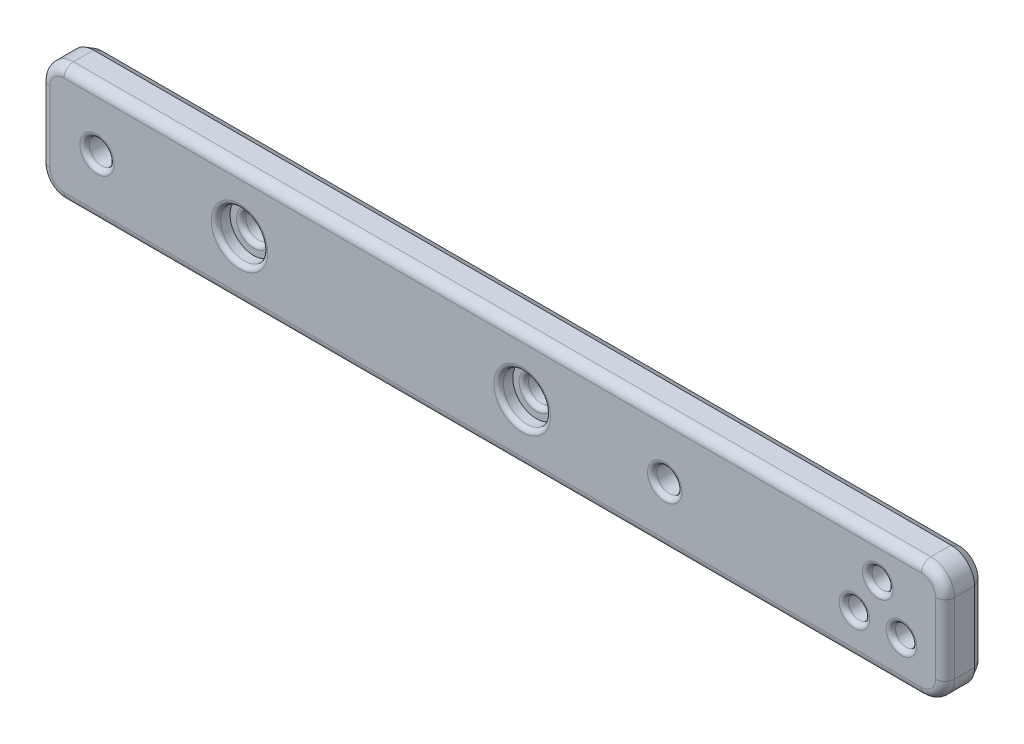
from build123d import *
from OCP.BRepFilletAPI import BRepFilletAPI_MakeChamfer

# Parameters (mm, degrees)
SKETCH2_W           = 192
SKETCH2_H           = 25
BOSS_EXTRUDE1_DEPTH = 8
SKETCH3_R           = 2.65
SKETCH3_R_2         = 2.25
CUT_EXTRUDE1_DEPTH  = 98.140362363
SKETCH4_R           = 5
CUT_EXTRUDE2_DEPTH  = 3
FILLET1_R           = 5
FILLET2_R           = 2
FILLET3_R           = 1
CHAMFER1_SIZE       = 1
CHAMFER1_SIZE2      = 1.732050808
CHAMFER2_SIZE       = 1
CHAMFER2_SIZE2      = 0.577350269


with BuildPart() as part:
    # Sketch2 → Boss-Extrude1 (new body)
    with BuildSketch(Plane.XY):
        Rectangle(SKETCH2_W, SKETCH2_H)
    extrude(amount=BOSS_EXTRUDE1_DEPTH)

    # Sketch3 → Cut-Extrude1 (cut, through all)
    with BuildSketch(Plane.XY.offset(8)):
        with Locations((-84, 0)):
            Circle(SKETCH3_R)
        with Locations((36.5, 0)):
            Circle(SKETCH3_R)
        with Locations((76.75, -3.5)):
            Circle(SKETCH3_R_2)
        with Locations((86.75, -3.5)):
            Circle(SKETCH3_R_2)
        with Locations((81.75, 4.5)):
            Circle(SKETCH3_R_2)
        with Locations((-53.75, 0)):
            Circle(SKETCH3_R)
        with Locations((6.25, 0)):
            Circle(SKETCH3_R)
    extrude(amount=-CUT_EXTRUDE1_DEPTH, mode=Mode.SUBTRACT)

    # Sketch4 → Cut-Extrude2 (cut)
    with BuildSketch(Plane.XY.offset(8)):
        with Locations((-53.75, 0)):
            Circle(SKETCH4_R)
        with Locations((6.25, 0)):
            Circle(SKETCH4_R)
    extrude(amount=-CUT_EXTRUDE2_DEPTH, mode=Mode.SUBTRACT)

    # Fillet1
    fillet1_edges = [part.edges().sort_by_distance(p)[0] for p in [
        (-96, -12.5, 4),
        (-96, 12.5, 4),
        (96, -12.5, 4),
        (96, 12.5, 4),
    ]]
    fillet(fillet1_edges, radius=FILLET1_R)

    # Fillet2
    fillet2_edges = [part.edges().sort_by_distance(p)[0] for p in [
        (94.535533906, 11.035533906, 8),
        (96, 0, 8),
        (94.535533906, -11.035533906, 8),
        (0, -12.5, 8),
        (-94.535533906, -11.035533906, 8),
        (-96, 0, 8),
        (-94.535533906, 11.035533906, 8),
        (0, 12.5, 8),
    ]]
    fillet(fillet2_edges, radius=FILLET2_R)

    # Fillet3
    fillet3_edges = [part.edges().sort_by_distance(p)[0] for p in [
        (79.5, 4.5, 8),
        (84.5, -3.5, 8),
        (74.5, -3.5, 8),
        (33.85, 0, 8),
        (-86.65, 0, 8),
        (3.6, 0, 5),
        (-56.4, 0, 5),
        (1.25, 0, 8),
        (-58.75, 0, 8),
    ]]
    fillet(fillet3_edges, radius=FILLET3_R)

    # Chamfer1
    chamfer1_edges = [part.edges().sort_by_distance(p)[0] for p in [
        (0, 12.5, 0),
        (-94.535533906, 11.035533906, 0),
        (94.535533906, 11.035533906, 0),
        (-96, 0, 0),
        (96, 0, 0),
        (-94.535533906, -11.035533906, 0),
        (94.535533906, -11.035533906, 0),
        (0, -12.5, 0),
    ]]
    chamfer1_side = [part.faces().sort_by_distance(p)[0] for p in [
        (-0.388718908, 0.008564373, 0),
    ]]
    chamfer(chamfer1_edges, length=CHAMFER1_SIZE, length2=CHAMFER1_SIZE2, reference=chamfer1_side[0])

    # Chamfer2: one chamfer whose edges measure the first distance from different faces: ONE call of the kernel's chamfer builder (chamfer() names one face for all edges)
    chamfer2_edges_1 = [part.edges().sort_by_distance(p)[0] for p in [
        (84.5, -3.5, 0),
    ]]
    chamfer2_side_1 = [part.faces().sort_by_distance(p)[0] for p in [
        (84.5, -3.5, 3.5),
    ]]
    chamfer2_edges_2 = [part.edges().sort_by_distance(p)[0] for p in [
        (79.5, 4.5, 0),
    ]]
    chamfer2_side_2 = [part.faces().sort_by_distance(p)[0] for p in [
        (79.5, 4.5, 3.5),
    ]]
    chamfer2_edges_3 = [part.edges().sort_by_distance(p)[0] for p in [
        (74.5, -3.5, 0),
    ]]
    chamfer2_side_3 = [part.faces().sort_by_distance(p)[0] for p in [
        (74.5, -3.5, 3.5),
    ]]
    chamfer2_edges_4 = [part.edges().sort_by_distance(p)[0] for p in [
        (33.85, 0, 0),
    ]]
    chamfer2_side_4 = [part.faces().sort_by_distance(p)[0] for p in [
        (33.85, 0, 3.5),
    ]]
    chamfer2_edges_5 = [part.edges().sort_by_distance(p)[0] for p in [
        (3.6, 0, 0),
    ]]
    chamfer2_side_5 = [part.faces().sort_by_distance(p)[0] for p in [
        (3.6, 0, 2),
    ]]
    chamfer2_edges_6 = [part.edges().sort_by_distance(p)[0] for p in [
        (-56.4, 0, 0),
    ]]
    chamfer2_side_6 = [part.faces().sort_by_distance(p)[0] for p in [
        (-56.4, 0, 2),
    ]]
    chamfer2_edges_7 = [part.edges().sort_by_distance(p)[0] for p in [
        (-86.65, 0, 0),
    ]]
    chamfer2_side_7 = [part.faces().sort_by_distance(p)[0] for p in [
        (-86.65, 0, 3.5),
    ]]
    chamfer2 = BRepFilletAPI_MakeChamfer(part.part.solid().wrapped)
    for e in chamfer2_edges_1:
        chamfer2.Add(CHAMFER2_SIZE, CHAMFER2_SIZE2, e.wrapped, chamfer2_side_1[0].wrapped)  # the first distance lies on this face
    for e in chamfer2_edges_2:
        chamfer2.Add(CHAMFER2_SIZE, CHAMFER2_SIZE2, e.wrapped, chamfer2_side_2[0].wrapped)  # the first distance lies on this face
    for e in chamfer2_edges_3:
        chamfer2.Add(CHAMFER2_SIZE, CHAMFER2_SIZE2, e.wrapped, chamfer2_side_3[0].wrapped)  # the first distance lies on this face
    for e in chamfer2_edges_4:
        chamfer2.Add(CHAMFER2_SIZE, CHAMFER2_SIZE2, e.wrapped, chamfer2_side_4[0].wrapped)  # the first distance lies on this face
    for e in chamfer2_edges_5:
        chamfer2.Add(CHAMFER2_SIZE, CHAMFER2_SIZE2, e.wrapped, chamfer2_side_5[0].wrapped)  # the first distance lies on this face
    for e in chamfer2_edges_6:
        chamfer2.Add(CHAMFER2_SIZE, CHAMFER2_SIZE2, e.wrapped, chamfer2_side_6[0].wrapped)  # the first distance lies on this face
    for e in chamfer2_edges_7:
        chamfer2.Add(CHAMFER2_SIZE, CHAMFER2_SIZE2, e.wrapped, chamfer2_side_7[0].wrapped)  # the first distance lies on this face
    add(Compound.cast(chamfer2.Shape()), mode=Mode.REPLACE)


solid = part.part
